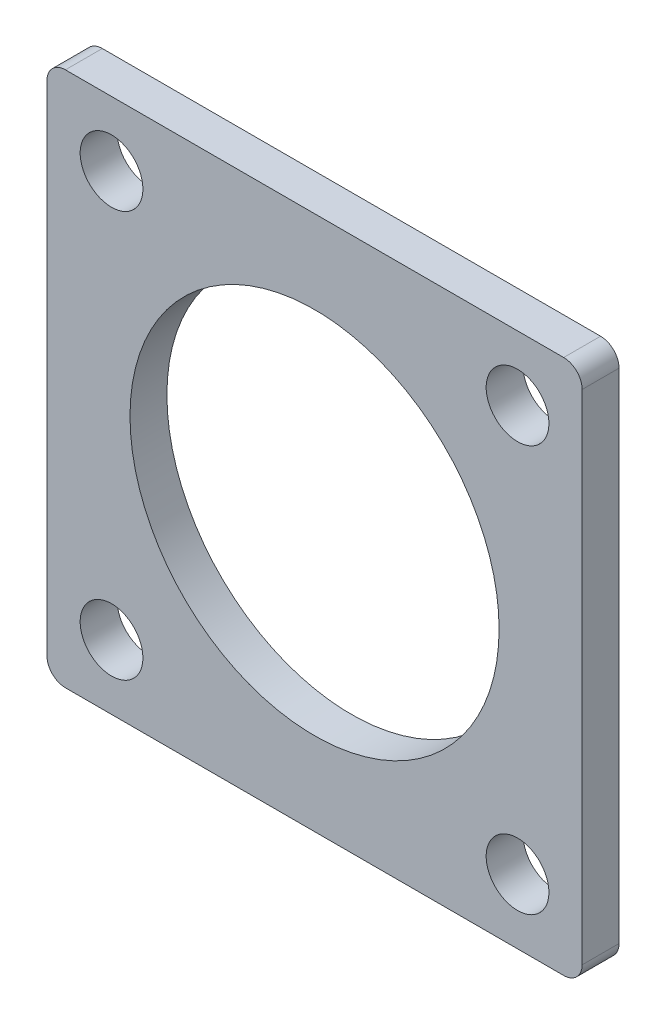
from build123d import *

# Parameters (mm, degrees)
SKETCH_1_W             = 29
SKETCH_1_H             = 29
EXTRUDE_1_DEPTH        = 2
FILLET_1_R             = 1
HOLE_WIZARD_M3_1_D     = 3.4
HOLE_WIZARD_M3_1_DEPTH = 7.5
HOLE_WIZARD_M3_1_TIP   = 1.021463052
SKETCH_4_R             = 10
CUT_EXTRUDE_1_DEPTH    = 21.603397778


with BuildPart() as part:
    # 草图1 → 凸台-拉伸1 (new body)
    with BuildSketch(Plane.XY):
        Rectangle(SKETCH_1_W, SKETCH_1_H)
    extrude(amount=EXTRUDE_1_DEPTH)

    # 圆角1
    fillet_1_edges = [part.edges().sort_by_distance(p)[0] for p in [
        (14.5, -14.5, 1),
        (-14.5, -14.5, 1),
        (-14.5, 14.5, 1),
        (14.5, 14.5, 1),
    ]]
    fillet(fillet_1_edges, radius=FILLET_1_R)

    # M3 间隙孔1
    with Locations(Plane.XY.offset(2)):
        with Locations((-11, 11), (11, 11), (-11, -11), (11, -11)):
            Hole(HOLE_WIZARD_M3_1_D / 2, depth=HOLE_WIZARD_M3_1_DEPTH)
            with Locations((0, 0, -(HOLE_WIZARD_M3_1_DEPTH + HOLE_WIZARD_M3_1_TIP / 2))):  # 118° drill point
                Cone(0, HOLE_WIZARD_M3_1_D / 2, HOLE_WIZARD_M3_1_TIP, mode=Mode.SUBTRACT)

    # 草图4 → 切除-拉伸1 (cut, through all)
    with BuildSketch(Plane.XY.offset(2)):
        Circle(SKETCH_4_R)
    extrude(amount=-CUT_EXTRUDE_1_DEPTH, mode=Mode.SUBTRACT)


solid = part.part
